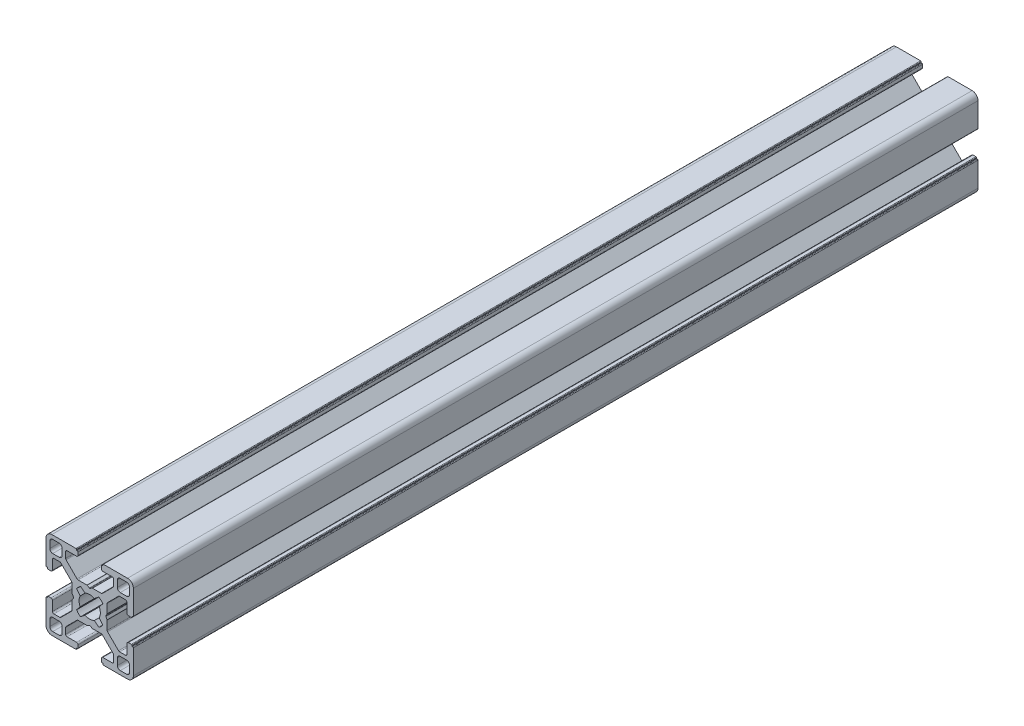
from build123d import *

# Parameters (mm, degrees)
AUFSATZ_LINEAR_AUSTRAGEN1_DEPTH = 290


with BuildPart() as part:
    # Skizze1 → Aufsatz-Linear austragen1 (new body)
    with BuildSketch(Plane.XY.offset(1000)):
        with BuildLine():
            Line((9.800000436, -10.500000436), (10.100000436, -10.500000436))
            ThreePointArc((10.100000436, -10.500000436), (10.241421792, -10.441421792), (10.300000436, -10.300000436))
            Line((10.300000436, -10.300000436), (10.300000436, -2))
            ThreePointArc((10.300000436, -2), (9.714213998, -0.585786438), (8.300000436, 0))
            Line((8.300000436, 0), (0, 0))
            ThreePointArc((0, 0), (-0.141421356, -0.058578644), (-0.2, -0.2))
            Line((-0.2, -0.2), (-0.2, -0.5))
            Line((-0.2, -0.5), (-0.49999919, -0.5))
            ThreePointArc((-0.49999919, -0.5), (-0.641420811, -0.558578753), (-0.699999564, -0.700000374))
            Line((-0.699999564, -0.700000374), (-0.699999564, -1.700000763))
            ThreePointArc((-0.699999564, -1.700000763), (-0.553552955, -2.053554154), (-0.199999564, -2.200000763))
            Line((-0.199999564, -2.200000763), (3.050000763, -2.200000763))
            ThreePointArc((3.050000763, -2.200000763), (3.403554154, -2.346447372), (3.550000763, -2.700000763))
            Line((3.550000763, -2.700000763), (3.550000763, -4.743055509))
            ThreePointArc((3.550000763, -4.743055509), (3.511993279, -4.934269826), (3.403749103, -5.096413843))
            Line((3.403749103, -5.096413843), (-0.349053376, -8.853358334))
            ThreePointArc((-0.349053376, -8.853358334), (-0.511332616, -8.961886981), (-0.702801716, -9))
            Line((-0.702801716, -9), (-3.746809419, -9))
            ThreePointArc((-3.746809419, -9), (-3.798212795, -9.006718618), (-3.846162576, -9.026423071))
            Line((-3.846162576, -9.026423071), (-4.600646407, -9.458279719))
            ThreePointArc((-4.600646407, -9.458279719), (-4.699999564, -9.48470279), (-4.799352721, -9.458279719))
            Line((-4.799352721, -9.458279719), (-5.553836552, -9.026423071))
            ThreePointArc((-5.553836552, -9.026423071), (-5.601786333, -9.006718618), (-5.653189709, -9))
            Line((-5.653189709, -9), (-8.697197412, -9))
            ThreePointArc((-8.697197412, -9), (-8.888666513, -8.961886981), (-9.050945752, -8.853358334))
            Line((-9.050945752, -8.853358334), (-12.803748231, -5.096413843))
            ThreePointArc((-12.803748231, -5.096413843), (-12.911992407, -4.934269826), (-12.949999891, -4.743055509))
            Line((-12.949999891, -4.743055509), (-12.949999891, -2.700000763))
            ThreePointArc((-12.949999891, -2.700000763), (-12.803553282, -2.346447372), (-12.449999891, -2.200000763))
            Line((-12.449999891, -2.200000763), (-9.199999564, -2.200000763))
            ThreePointArc((-9.199999564, -2.200000763), (-8.846446173, -2.053554154), (-8.699999564, -1.700000763))
            Line((-8.699999564, -1.700000763), (-8.699999564, -0.700000374))
            ThreePointArc((-8.699999564, -0.700000374), (-8.758578317, -0.558578753), (-8.899999938, -0.5))
            Line((-8.899999938, -0.5), (-9.199999128, -0.5))
            Line((-9.199999128, -0.5), (-9.199999128, -0.2))
            ThreePointArc((-9.199999128, -0.2), (-9.258577772, -0.058578644), (-9.399999128, 0))
            Line((-9.399999128, 0), (-17.699999564, 0))
            ThreePointArc((-17.699999564, 0), (-19.114213126, -0.585786438), (-19.699999564, -2))
            Line((-19.699999564, -2), (-19.699999564, -10.300000436))
            ThreePointArc((-19.699999564, -10.300000436), (-19.64142092, -10.441421792), (-19.499999564, -10.500000436))
            Line((-19.499999564, -10.500000436), (-19.199999564, -10.500000436))
            Line((-19.199999564, -10.500000436), (-19.199999564, -10.799999627))
            ThreePointArc((-19.199999564, -10.799999627), (-19.141420811, -10.941421247), (-18.99999919, -11))
            Line((-18.99999919, -11), (-17.999998801, -11))
            ThreePointArc((-17.999998801, -11), (-17.64644541, -10.853553391), (-17.499998801, -10.5))
            Line((-17.499998801, -10.5), (-17.499998801, -7.249999673))
            ThreePointArc((-17.499998801, -7.249999673), (-17.353552192, -6.896446283), (-16.999998801, -6.749999673))
            Line((-16.999998801, -6.749999673), (-14.956944055, -6.749999673))
            ThreePointArc((-14.956944055, -6.749999673), (-14.765729738, -6.788007157), (-14.603585721, -6.896251334))
            Line((-14.603585721, -6.896251334), (-10.84664123, -10.649053813))
            ThreePointArc((-10.84664123, -10.649053813), (-10.738112583, -10.811333052), (-10.699999564, -11.002802152))
            Line((-10.699999564, -11.002802152), (-10.699999564, -14.046809855))
            ThreePointArc((-10.699999564, -14.046809855), (-10.693280947, -14.098213232), (-10.673576493, -14.146163012))
            Line((-10.673576493, -14.146163012), (-10.241719845, -14.900646843))
            ThreePointArc((-10.241719845, -14.900646843), (-10.215296774, -15), (-10.241719845, -15.099353157))
            Line((-10.241719845, -15.099353157), (-10.673576493, -15.853836988))
            ThreePointArc((-10.673576493, -15.853836988), (-10.693280947, -15.901786769), (-10.699999564, -15.953190146))
            Line((-10.699999564, -15.953190146), (-10.699999564, -18.997197848))
            ThreePointArc((-10.699999564, -18.997197848), (-10.738112583, -19.188666949), (-10.84664123, -19.350946188))
            Line((-10.84664123, -19.350946188), (-14.603585721, -23.103748667))
            ThreePointArc((-14.603585721, -23.103748667), (-14.765729738, -23.211992843), (-14.956944055, -23.250000327))
            Line((-14.956944055, -23.250000327), (-16.999998801, -23.250000327))
            ThreePointArc((-16.999998801, -23.250000327), (-17.353552192, -23.103553718), (-17.499998801, -22.750000327))
            Line((-17.499998801, -22.750000327), (-17.499998801, -19.5))
            ThreePointArc((-17.499998801, -19.5), (-17.64644541, -19.14644661), (-17.999998801, -19))
            Line((-17.999998801, -19), (-18.99999919, -19))
            ThreePointArc((-18.99999919, -19), (-19.141420811, -19.058578753), (-19.199999564, -19.200000374))
            Line((-19.199999564, -19.200000374), (-19.199999564, -19.499999564))
            Line((-19.199999564, -19.499999564), (-19.499999564, -19.499999564))
            ThreePointArc((-19.499999564, -19.499999564), (-19.64142092, -19.558578208), (-19.699999564, -19.699999564))
            Line((-19.699999564, -19.699999564), (-19.699999564, -28))
            ThreePointArc((-19.699999564, -28), (-19.114213126, -29.414213563), (-17.699999564, -30))
            Line((-17.699999564, -30), (-9.399999128, -30))
            ThreePointArc((-9.399999128, -30), (-9.258577772, -29.941421356), (-9.199999128, -29.8))
            Line((-9.199999128, -29.8), (-9.199999128, -29.5))
            Line((-9.199999128, -29.5), (-8.899999938, -29.5))
            ThreePointArc((-8.899999938, -29.5), (-8.758578317, -29.441421247), (-8.699999564, -29.299999627))
            Line((-8.699999564, -29.299999627), (-8.699999564, -28.299999237))
            ThreePointArc((-8.699999564, -28.299999237), (-8.846446173, -27.946445847), (-9.199999564, -27.799999237))
            Line((-9.199999564, -27.799999237), (-12.449999891, -27.799999237))
            ThreePointArc((-12.449999891, -27.799999237), (-12.803553282, -27.653552628), (-12.949999891, -27.299999237))
            Line((-12.949999891, -27.299999237), (-12.949999891, -25.256944491))
            ThreePointArc((-12.949999891, -25.256944491), (-12.911992407, -25.065730174), (-12.803748231, -24.903586157))
            Line((-12.803748231, -24.903586157), (-9.050945752, -21.146641666))
            ThreePointArc((-9.050945752, -21.146641666), (-8.888666513, -21.038113019), (-8.697197412, -21))
            Line((-8.697197412, -21), (-5.653189709, -21))
            ThreePointArc((-5.653189709, -21), (-5.601786333, -20.993281383), (-5.553836552, -20.973576929))
            Line((-5.553836552, -20.973576929), (-4.799352721, -20.541720281))
            ThreePointArc((-4.799352721, -20.541720281), (-4.699999564, -20.51529721), (-4.600646407, -20.541720281))
            Line((-4.600646407, -20.541720281), (-3.846162576, -20.973576929))
            ThreePointArc((-3.846162576, -20.973576929), (-3.798212795, -20.993281383), (-3.746809419, -21))
            Line((-3.746809419, -21), (-0.702801716, -21))
            ThreePointArc((-0.702801716, -21), (-0.511332616, -21.038113019), (-0.349053377, -21.146641666))
            Line((-0.349053377, -21.146641666), (3.403749103, -24.903586157))
            ThreePointArc((3.403749103, -24.903586157), (3.511993279, -25.065730174), (3.550000763, -25.256944491))
            Line((3.550000763, -25.256944491), (3.550000763, -27.299999237))
            ThreePointArc((3.550000763, -27.299999237), (3.403554154, -27.653552628), (3.050000763, -27.799999237))
            Line((3.050000763, -27.799999237), (-0.199999564, -27.799999237))
            ThreePointArc((-0.199999564, -27.799999237), (-0.553552955, -27.946445847), (-0.699999564, -28.299999237))
            Line((-0.699999564, -28.299999237), (-0.699999564, -29.299999627))
            ThreePointArc((-0.699999564, -29.299999627), (-0.641420811, -29.441421247), (-0.49999919, -29.5))
            Line((-0.49999919, -29.5), (-0.2, -29.5))
            Line((-0.2, -29.5), (-0.2, -29.8))
            ThreePointArc((-0.2, -29.8), (-0.141421356, -29.941421356), (0, -30))
            Line((0, -30), (8.300000436, -30))
            ThreePointArc((8.300000436, -30), (9.714213998, -29.414213563), (10.300000436, -28))
            Line((10.300000436, -28), (10.300000436, -19.699999564))
            ThreePointArc((10.300000436, -19.699999564), (10.241421792, -19.558578208), (10.100000436, -19.499999564))
            Line((10.100000436, -19.499999564), (9.800000436, -19.499999564))
            Line((9.800000436, -19.499999564), (9.800000436, -19.200000374))
            ThreePointArc((9.800000436, -19.200000374), (9.741421683, -19.058578753), (9.600000062, -19))
            Line((9.600000062, -19), (8.599999673, -19))
            ThreePointArc((8.599999673, -19), (8.246446283, -19.14644661), (8.099999673, -19.5))
            Line((8.099999673, -19.5), (8.099999673, -22.750000327))
            ThreePointArc((8.099999673, -22.750000327), (7.953553064, -23.103553718), (7.599999673, -23.250000327))
            Line((7.599999673, -23.250000327), (5.556944927, -23.250000327))
            ThreePointArc((5.556944927, -23.250000327), (5.36573061, -23.211992843), (5.203586593, -23.103748667))
            Line((5.203586593, -23.103748667), (1.446642102, -19.350946188))
            ThreePointArc((1.446642102, -19.350946188), (1.338113455, -19.188666949), (1.300000436, -18.997197848))
            Line((1.300000436, -18.997197848), (1.300000436, -15.953190145))
            ThreePointArc((1.300000436, -15.953190145), (1.293281819, -15.901786769), (1.273577365, -15.853836988))
            Line((1.273577365, -15.853836988), (0.841720717, -15.099353157))
            ThreePointArc((0.841720717, -15.099353157), (0.815297646, -15), (0.841720717, -14.900646843))
            Line((0.841720717, -14.900646843), (1.273577365, -14.146163012))
            ThreePointArc((1.273577365, -14.146163012), (1.293281819, -14.098213231), (1.300000436, -14.046809855))
            Line((1.300000436, -14.046809855), (1.300000436, -11.002802152))
            ThreePointArc((1.300000436, -11.002802152), (1.338113455, -10.811333051), (1.446642102, -10.649053812))
            Line((1.446642102, -10.649053812), (5.203586593, -6.896251334))
            ThreePointArc((5.203586593, -6.896251334), (5.36573061, -6.788007157), (5.556944927, -6.749999673))
            Line((5.556944927, -6.749999673), (7.599999673, -6.749999673))
            ThreePointArc((7.599999673, -6.749999673), (7.953553064, -6.896446283), (8.099999673, -7.249999673))
            Line((8.099999673, -7.249999673), (8.099999673, -10.5))
            ThreePointArc((8.099999673, -10.5), (8.246446283, -10.853553391), (8.599999673, -11))
            Line((8.599999673, -11), (9.600000062, -11))
            ThreePointArc((9.600000062, -11), (9.741421683, -10.941421247), (9.800000436, -10.799999627))
            Line((9.800000436, -10.799999627), (9.800000436, -10.500000436))
        make_face()
        with BuildLine():
            Line((8.000001536, -5.500000365), (5.800000754, -5.500000365))
            ThreePointArc((5.800000754, -5.500000365), (5.092893979, -5.207107149), (4.800000763, -4.500000374))
            Line((4.800000763, -4.500000374), (4.800000763, -2.299999592))
            ThreePointArc((4.800000763, -2.299999592), (5.092893979, -1.592892818), (5.800000754, -1.299999602))
            Line((5.800000754, -1.299999602), (8.000001536, -1.299999602))
            ThreePointArc((8.000001536, -1.299999602), (8.70710831, -1.592892818), (9.000001526, -2.299999592))
            Line((9.000001526, -2.299999592), (9.000001526, -4.500000374))
            ThreePointArc((9.000001526, -4.500000374), (8.70710831, -5.207107149), (8.000001536, -5.500000365))
        make_face(mode=Mode.SUBTRACT)
        with BuildLine():
            Line((-15.199999881, -5.500000365), (-17.400000663, -5.500000365))
            ThreePointArc((-17.400000663, -5.500000365), (-18.107107438, -5.207107149), (-18.400000654, -4.500000374))
            Line((-18.400000654, -4.500000374), (-18.400000654, -2.299999592))
            ThreePointArc((-18.400000654, -2.299999592), (-18.107107438, -1.592892818), (-17.400000664, -1.299999602))
            Line((-17.400000664, -1.299999602), (-15.199999881, -1.299999602))
            ThreePointArc((-15.199999881, -1.299999602), (-14.492893107, -1.592892818), (-14.199999891, -2.299999592))
            Line((-14.199999891, -2.299999592), (-14.199999891, -4.500000374))
            ThreePointArc((-14.199999891, -4.500000374), (-14.492893107, -5.207107149), (-15.199999881, -5.500000365))
        make_face(mode=Mode.SUBTRACT)
        with BuildLine():
            Line((-17.400000664, -24.499999636), (-15.199999881, -24.499999636))
            ThreePointArc((-15.199999881, -24.499999636), (-14.492893107, -24.792892852), (-14.199999891, -25.499999626))
            Line((-14.199999891, -25.499999626), (-14.199999891, -27.700000408))
            ThreePointArc((-14.199999891, -27.700000408), (-14.492893107, -28.407107183), (-15.199999881, -28.700000399))
            Line((-15.199999881, -28.700000399), (-17.400000663, -28.700000399))
            ThreePointArc((-17.400000663, -28.700000399), (-18.107107438, -28.407107183), (-18.400000654, -27.700000408))
            Line((-18.400000654, -27.700000408), (-18.400000654, -25.499999626))
            ThreePointArc((-18.400000654, -25.499999626), (-18.107107438, -24.792892852), (-17.400000664, -24.499999636))
        make_face(mode=Mode.SUBTRACT)
        with BuildLine():
            Line((5.800000754, -24.499999636), (8.000001536, -24.499999636))
            ThreePointArc((8.000001536, -24.499999636), (8.70710831, -24.792892852), (9.000001526, -25.499999626))
            Line((9.000001526, -25.499999626), (9.000001526, -27.700000408))
            ThreePointArc((9.000001526, -27.700000408), (8.70710831, -28.407107183), (8.000001536, -28.700000399))
            Line((8.000001536, -28.700000399), (5.800000754, -28.700000399))
            ThreePointArc((5.800000754, -28.700000399), (5.092893979, -28.407107183), (4.800000763, -27.700000408))
            Line((4.800000763, -27.700000408), (4.800000763, -25.499999626))
            ThreePointArc((4.800000763, -25.499999626), (5.092893979, -24.792892852), (5.800000754, -24.499999636))
        make_face(mode=Mode.SUBTRACT)
        with BuildLine():
            Line((-7.835928976, -10.481599097), (-6.300129088, -11.719438233))
            ThreePointArc((-6.300129088, -11.719438233), (-4.699999564, -11.35), (-3.09987004, -11.719438233))
            Line((-3.09987004, -11.719438233), (-1.564070152, -10.481599097))
            ThreePointArc((-1.564070152, -10.481599097), (-0.818997305, -11.10284444), (-0.194662672, -11.845330527))
            Line((-0.194662672, -11.845330527), (-1.419437832, -13.399870404))
            ThreePointArc((-1.419437832, -13.399870404), (-1.049999564, -15), (-1.419437832, -16.600129597))
            Line((-1.419437832, -16.600129597), (-0.194662672, -18.154669473))
            ThreePointArc((-0.194662672, -18.154669473), (-0.818997305, -18.897155561), (-1.564070152, -19.518400903))
            Line((-1.564070152, -19.518400903), (-3.09987004, -18.280561767))
            ThreePointArc((-3.09987004, -18.280561767), (-4.699999564, -18.65), (-6.300129088, -18.280561767))
            Line((-6.300129088, -18.280561767), (-7.835928976, -19.518400903))
            ThreePointArc((-7.835928976, -19.518400903), (-8.581001823, -18.897155561), (-9.205336456, -18.154669473))
            Line((-9.205336456, -18.154669473), (-7.980561295, -16.600129597))
            ThreePointArc((-7.980561295, -16.600129597), (-8.349999564, -15), (-7.980561296, -13.399870404))
            Line((-7.980561296, -13.399870404), (-9.205336456, -11.845330527))
            ThreePointArc((-9.205336456, -11.845330527), (-8.581001823, -11.10284444), (-7.835928976, -10.481599097))
        make_face(mode=Mode.SUBTRACT)
    extrude(amount=-AUFSATZ_LINEAR_AUSTRAGEN1_DEPTH)


solid = part.part
